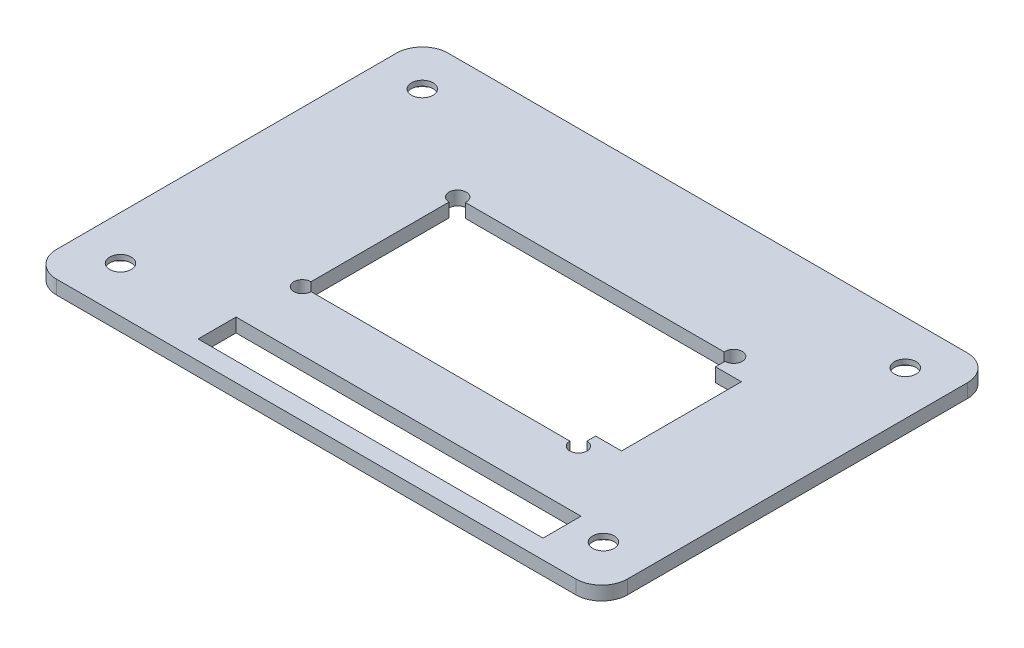
from build123d import *

# Parameters (mm, degrees)
EXTRUDE_1_DEPTH       = 1.6
SKETCH_5_R            = 2.6
CUT_EXTRUDE_855_DEPTH = 1
CUT_EXTRUDE_992_REACH = 42.148
SKETCH_7_R            = 1.25
CUT_EXTRUDE_1_REACH   = 42.168
SKETCH_9_W            = 40
SKETCH_9_H            = 4.4


with BuildPart() as part:
    # 草图1 → 凸台-拉伸1 (new body)
    with BuildSketch(Plane(origin=(0, 0, 0), x_dir=(1, 0, 0), z_dir=(0, 1, 0))):
        with BuildLine():
            Line((-30.1, -22.7), (30.1, -22.7))
            ThreePointArc((30.1, -22.7), (32.221320344, -21.821320344), (33.1, -19.7))
            Line((33.1, -19.7), (33.1, 19.7))
            ThreePointArc((33.1, 19.7), (32.221320344, 21.821320344), (30.1, 22.7))
            Line((30.1, 22.7), (-30.1, 22.7))
            ThreePointArc((-30.1, 22.7), (-32.221320344, 21.821320344), (-33.1, 19.7))
            Line((-33.1, 19.7), (-33.1, -19.7))
            ThreePointArc((-33.1, -19.7), (-32.221320344, -21.821320344), (-30.1, -22.7))
        make_face()
    extrude(amount=EXTRUDE_1_DEPTH)

    # 草图5 → Cut-Extrude 855 (cut)
    with BuildSketch(Plane.XZ):
        with Locations(Location((-28, -17.6, 0), (0, 0, 270))):
            Circle(SKETCH_5_R)
        with Locations(Location((28, -17.6, 0), (0, 0, 270))):
            Circle(SKETCH_5_R)
        with Locations(Location((28, 17.4, 0), (0, 0, 270))):
            Circle(SKETCH_5_R)
        with Locations(Location((-28, 17.4, 0), (0, 0, 270))):
            Circle(SKETCH_5_R)
    extrude(amount=-CUT_EXTRUDE_855_DEPTH, mode=Mode.SUBTRACT)

    # 草图7 → Cut-Extrude 992 (cut, up to next)
    with BuildSketch(Plane.XZ.offset(-1), mode=Mode.PRIVATE) as cut_extrude_992_sk1:
        with Locations(Location((-28, -17.6, 0), (0, 0, 270))):
            Circle(SKETCH_7_R)
    cut_extrude_992_tool1 = extrude(cut_extrude_992_sk1.sketch, amount=-CUT_EXTRUDE_992_REACH, mode=Mode.PRIVATE) & part.part
    # 草图7 → Cut-Extrude 992 (cut, up to next)
    with BuildSketch(Plane.XZ.offset(-1), mode=Mode.PRIVATE) as cut_extrude_992_sk2:
        with Locations(Location((28, -17.6, 0), (0, 0, 270))):
            Circle(SKETCH_7_R)
    cut_extrude_992_tool2 = extrude(cut_extrude_992_sk2.sketch, amount=-CUT_EXTRUDE_992_REACH, mode=Mode.PRIVATE) & part.part
    # 草图7 → Cut-Extrude 992 (cut, up to next)
    with BuildSketch(Plane.XZ.offset(-1), mode=Mode.PRIVATE) as cut_extrude_992_sk3:
        with Locations(Location((28, 17.4, 0), (0, 0, 270))):
            Circle(SKETCH_7_R)
    cut_extrude_992_tool3 = extrude(cut_extrude_992_sk3.sketch, amount=-CUT_EXTRUDE_992_REACH, mode=Mode.PRIVATE) & part.part
    # 草图7 → Cut-Extrude 992 (cut, up to next)
    with BuildSketch(Plane.XZ.offset(-1), mode=Mode.PRIVATE) as cut_extrude_992_sk4:
        with Locations(Location((-28, 17.4, 0), (0, 0, 270))):
            Circle(SKETCH_7_R)
    cut_extrude_992_tool4 = extrude(cut_extrude_992_sk4.sketch, amount=-CUT_EXTRUDE_992_REACH, mode=Mode.PRIVATE) & part.part
    add(cut_extrude_992_tool1.solids().sort_by_distance((-28, 1, -17.6))[0], mode=Mode.SUBTRACT)
    add(cut_extrude_992_tool2.solids().sort_by_distance((28, 1, -17.6))[0], mode=Mode.SUBTRACT)
    add(cut_extrude_992_tool3.solids().sort_by_distance((28, 1, 17.4))[0], mode=Mode.SUBTRACT)
    add(cut_extrude_992_tool4.solids().sort_by_distance((-28, 1, 17.4))[0], mode=Mode.SUBTRACT)

    # 草图9 → 切除-拉伸1 (cut, up to next)
    with BuildSketch(Plane(origin=(0, 0, 0), x_dir=(-1, 0, 0), z_dir=(0, -1, 0)), mode=Mode.PRIVATE) as cut_extrude_1_sk1:
        with Locations((-4.1, -18.3)):
            Rectangle(SKETCH_9_W, SKETCH_9_H)
    cut_extrude_1_tool1 = extrude(cut_extrude_1_sk1.sketch, amount=-CUT_EXTRUDE_1_REACH, mode=Mode.PRIVATE) & part.part
    # 草图9 → 切除-拉伸1 (cut, up to next)
    with BuildSketch(Plane(origin=(0, 0, 0), x_dir=(-1, 0, 0), z_dir=(0, -1, 0)), mode=Mode.PRIVATE) as cut_extrude_1_sk2:
        with BuildLine():
            Line((-16.900000063, -7.2), (-16.900000063, -8.200012563))
            ThreePointArc((-16.900000063, -8.200012563), (-17.613889315, -9.905332368), (-15.905012563, -9.2))
            Line((-15.905012563, -9.2), (14.1, -9.2))
            ThreePointArc((14.1, -9.2), (15.807106781, -9.907106781), (15.1, -8.2))
            Line((15.1, -8.2), (15.1, 7.8))
            ThreePointArc((15.1, 7.8), (15.770820393, 9.541619849), (14.105012563, 8.7))
            Line((14.105012563, 8.7), (-15.905012563, 8.7))
            ThreePointArc((-15.905012563, 8.7), (-17.57082037, 9.54161987), (-16.900000063, 7.8))
            Line((-16.900000063, 7.8), (-16.900000063, 6.7))
            Line((-16.900000063, 6.7), (-19.900000063, 6.7))
            Line((-19.900000063, 6.7), (-19.900000063, -7.2))
            Line((-19.900000063, -7.2), (-16.900000063, -7.2))
        make_face()
    cut_extrude_1_tool2 = extrude(cut_extrude_1_sk2.sketch, amount=-CUT_EXTRUDE_1_REACH, mode=Mode.PRIVATE) & part.part
    add(cut_extrude_1_tool1.solids().sort_by_distance((4.1, 0, 18.3))[0], mode=Mode.SUBTRACT)
    add(cut_extrude_1_tool2.solids().sort_by_distance((2.069376, 0, 0.246434))[0], mode=Mode.SUBTRACT)


solid = part.part
